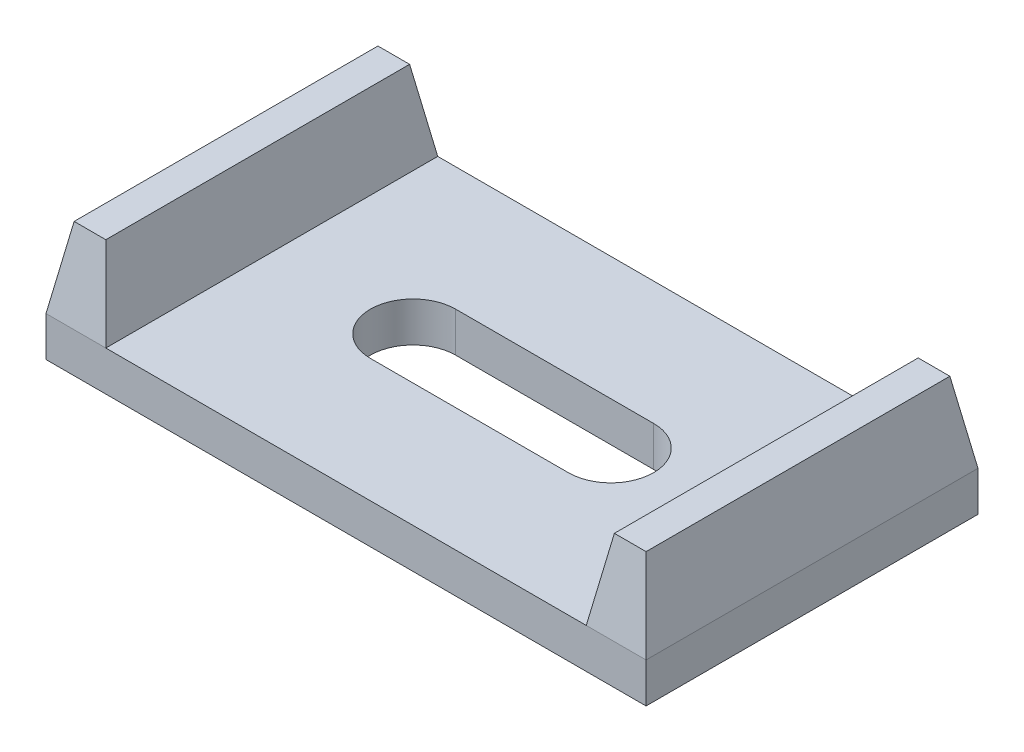
from build123d import *

# Parameters (mm, degrees)
SKETCH11_W                    = 150.473018286
SKETCH11_H                    = 83.2350749
BOSS_EXTRUDE1_DEPTH           = 10
SKETCH13_W                    = 15
SKETCH13_H                    = 83.2350749
BOSS_EXTRUDE2_DEPTH           = 20
BOSS_EXTRUDE2_DRAFT           = 10
BOSS_EXTRUDE2_PROFILE_2_DEPTH = 20
BOSS_EXTRUDE2_PROFILE_2_DRAFT = 10
SKETCH16_R                    = 10.695894528
SKETCH16_W                    = 49.642014298
SKETCH16_H                    = 21.391789056
CUT_EXTRUDE17_DEPTH           = 10


with BuildPart() as part:
    # Sketch11 → Boss-Extrude1 (new body)
    with BuildSketch(Plane(origin=(0, 0, 0), x_dir=(1, 0, 0), z_dir=(0, 1, 0))):
        Rectangle(SKETCH11_W, SKETCH11_H)
    extrude(amount=BOSS_EXTRUDE1_DEPTH)


with BuildPart() as boss_extrude2_tool:
    # Sketch13 → Boss-Extrude2 (with draft: the straight prism first)
    with BuildSketch(Plane(origin=(0, 10, 0), x_dir=(1, 0, 0), z_dir=(0, 1, 0))):
        with Locations((-67.736509143, 0)):
            Rectangle(SKETCH13_W, SKETCH13_H)
    extrude(amount=BOSS_EXTRUDE2_DEPTH)
    # Boss-Extrude2: the draft: its side faces are tilted about the plane it starts from
    boss_extrude2_sides = [boss_extrude2_tool.faces().sort_by_distance(p)[0] for p in [
        (-75.236509143, 20, 0),
        (-67.736509143, 20, 41.61753745),
        (-60.236509143, 20, 0),
        (-67.736509143, 20, -41.61753745),
    ]]
    draft(boss_extrude2_sides, Plane(origin=(0, 10, 0), x_dir=(1, 0, 0), z_dir=(0, 1, 0)), BOSS_EXTRUDE2_DRAFT)


with BuildPart() as part_1:
    add(part.part)

    # Boss-Extrude2: add boss_extrude2_tool
    add(boss_extrude2_tool.part)


with BuildPart() as boss_extrude2_profile_2_tool:
    # Sketch13 → Boss-Extrude2 profile 2 (with draft: the straight prism first)
    with BuildSketch(Plane(origin=(0, 10, 0), x_dir=(1, 0, 0), z_dir=(0, 1, 0))):
        with Locations((67.736509143, 0)):
            Rectangle(SKETCH13_W, SKETCH13_H)
    extrude(amount=BOSS_EXTRUDE2_PROFILE_2_DEPTH)
    # Boss-Extrude2 profile 2: the draft: its side faces are tilted about the plane it starts from
    boss_extrude2_profile_2_sides = [boss_extrude2_profile_2_tool.faces().sort_by_distance(p)[0] for p in [
        (67.736509143, 20, -41.61753745),
        (60.236509143, 20, 0),
        (67.736509143, 20, 41.61753745),
        (75.236509143, 20, 0),
    ]]
    draft(boss_extrude2_profile_2_sides, Plane(origin=(0, 10, 0), x_dir=(1, 0, 0), z_dir=(0, 1, 0)), BOSS_EXTRUDE2_PROFILE_2_DRAFT)


with BuildPart() as part_2:
    add(part_1.part)

    # Boss-Extrude2 profile 2: add boss_extrude2_profile_2_tool
    add(boss_extrude2_profile_2_tool.part)

    # Sketch16 → Cut-Extrude17 (cut)
    with BuildSketch(Plane(origin=(0, 10, 0), x_dir=(1, 0, 0), z_dir=(0, 1, 0))):
        with Locations((24.821007149, 0)):
            Circle(SKETCH16_R)
        with Locations((-24.821007149, 0)):
            Circle(SKETCH16_R)
        Rectangle(SKETCH16_W, SKETCH16_H)
    extrude(amount=-CUT_EXTRUDE17_DEPTH, mode=Mode.SUBTRACT)


solid = part_2.part
